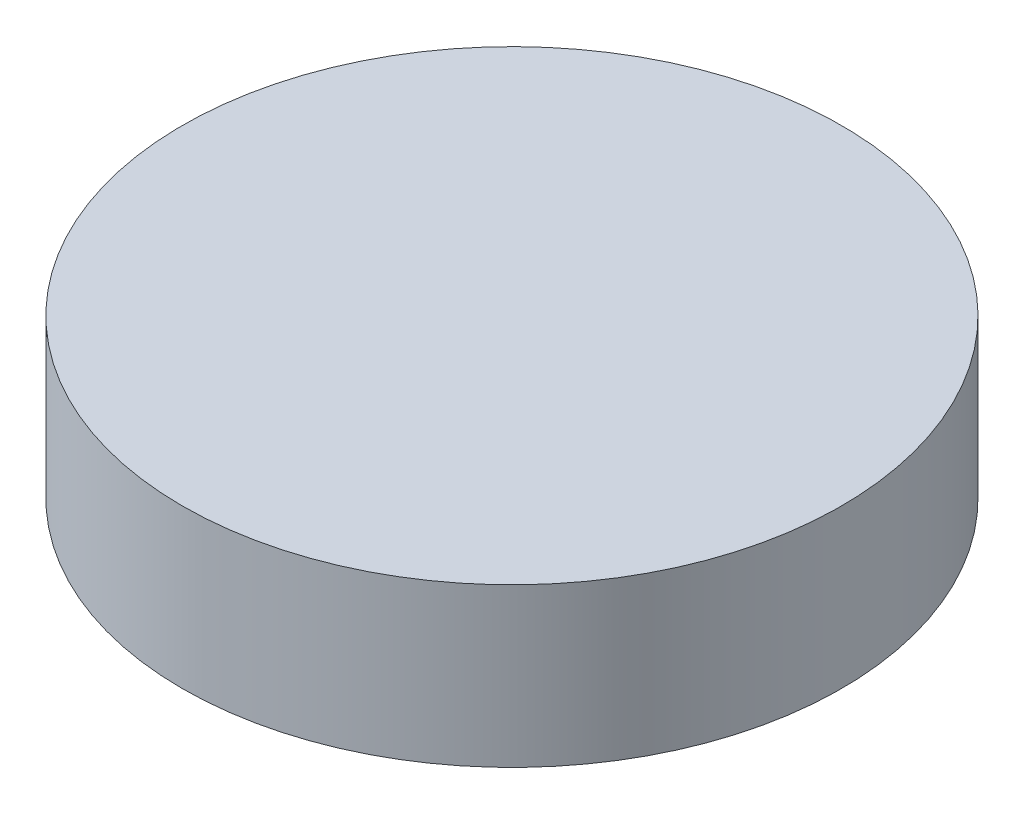
from build123d import *

# Parameters (mm, degrees)
SKETCH1_R               = 25
PACK_AYAR_AYAGI_2_DEPTH = 12


with BuildPart() as part:
    # Sketch1 → PACK_ayar_ayagi_2 (new body)
    with BuildSketch(Plane(origin=(0, 0, 0), x_dir=(1, 0, 0), z_dir=(0, 1, 0))):
        with Locations(Location((650, 50, 0), (0, 0, 270))):
            Circle(SKETCH1_R)
    extrude(amount=PACK_AYAR_AYAGI_2_DEPTH)


solid = part.part
